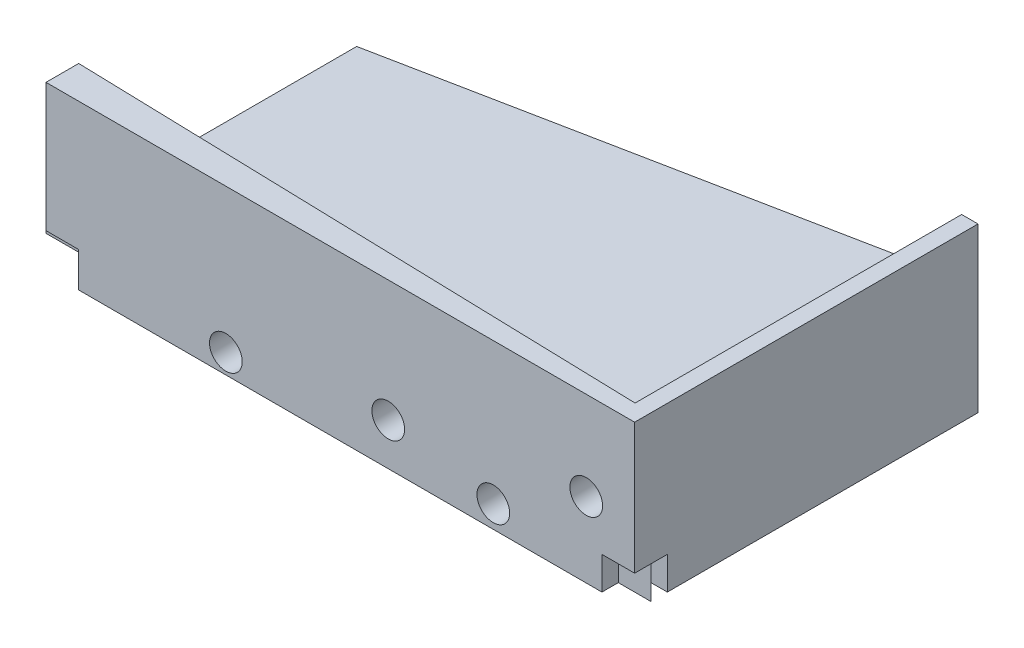
from build123d import *

# Parameters (mm, degrees)
ESQUISSE1_R             = 3
BOSS_EXTRU_1_DEPTH      = 200
ESQUISSE4_W             = 5
ESQUISSE4_H             = 50
BOSS_EXTRU_4_DEPTH      = 180
BOSS_EXTRU_7_DEPTH      = 50
ESQUISSE6_W             = 20
ESQUISSE6_H             = 10.719834163
ENL_V_MAT_EXTRU_2_DEPTH = 10
ESQUISSE5_W             = 10
ESQUISSE5_H             = 10
ENL_V_MAT_EXTRU_1_DEPTH = 10
ESQUISSE14_R            = 5
ENL_V_MAT_EXTRU_4_DEPTH = 15
BOSS_EXTRU_8_REACH      = 242.401
ESQUISSE16_W            = 210.874992539
ESQUISSE16_H            = 82.741703247
ENL_V_MAT_EXTRU_5_DEPTH = 130


with BuildPart() as part:
    # Esquisse1 → Boss.-Extru.1 (new body)
    with BuildSketch(Plane.XY):
        Polygon((-105.796013405, 0), (84.203986595, 0), (84.203986595, 33.502126335), (-105.796013405, 2), align=None)
        with Locations((69.406004871, 22.939397164)):
            Circle(ESQUISSE1_R, mode=Mode.SUBTRACT)
        with Locations((40.981469067, 6.77616521)):
            Circle(ESQUISSE1_R, mode=Mode.SUBTRACT)
        with Locations((-40.796013405, 6)):
            Circle(ESQUISSE1_R, mode=Mode.SUBTRACT)
        with Locations((8.861542866, 12.901085106)):
            Circle(ESQUISSE1_R, mode=Mode.SUBTRACT)
    extrude(amount=BOSS_EXTRU_1_DEPTH)

    # Esquisse4 → Boss.-Extru.4 (add)
    with BuildSketch(Plane(origin=(84.203986595, 0, 0), x_dir=(0, 0, -1), z_dir=(1, 0, 0))):
        with Locations((-202.5, 25)):
            Rectangle(ESQUISSE4_W, ESQUISSE4_H)
        with Locations((2.5, 25)):
            Rectangle(ESQUISSE4_W, ESQUISSE4_H)
    extrude(amount=-BOSS_EXTRU_4_DEPTH)

    # Esquisse8 → Boss.-Extru.7 (add)
    with BuildSketch(Plane(origin=(0, 50, 0), x_dir=(1, 0, 0), z_dir=(0, 1, 0))):
        Polygon((84.203986595, 0), (-95.796013405, 0), (-95.796013405, -5), align=None)
    boss_extru_7 = extrude(amount=-BOSS_EXTRU_7_DEPTH)

    # Esquisse6 → Enlèv. mat.-Extru.2 (cut)
    with BuildSketch(Plane(origin=(0, 0, -5), x_dir=(-1, 0, 0), z_dir=(0, 0, -1))):
        with Locations((95.796013405, 5.359917081)):
            Rectangle(ESQUISSE6_W, ESQUISSE6_H)
    enl_v_mat_extru_2 = extrude(amount=-ENL_V_MAT_EXTRU_2_DEPTH, mode=Mode.SUBTRACT)

    # Esquisse5 → Enlèv. mat.-Extru.1 (cut)
    with BuildSketch(Plane(origin=(84.203986595, 0, 0), x_dir=(0, 0, -1), z_dir=(1, 0, 0))):
        with Locations((-200, 5)):
            Rectangle(ESQUISSE5_W, ESQUISSE5_H)
        with Locations((0, 5)):
            Rectangle(ESQUISSE5_W, ESQUISSE5_H)
    extrude(amount=-ENL_V_MAT_EXTRU_1_DEPTH, mode=Mode.SUBTRACT)

    # Esquisse14 → Enlèv. mat.-Extru.4 (cut)
    with BuildSketch(Plane(origin=(0, 0, -5), x_dir=(-1, 0, 0), z_dir=(0, 0, -1))):
        with Locations((-69.406004871, 22.939397164)):
            Circle(ESQUISSE14_R)
        with Locations((-40.981469067, 6.77616521)):
            Circle(ESQUISSE14_R)
        with Locations((-8.861542866, 12.901085106)):
            Circle(ESQUISSE14_R)
        with Locations((40.796013405, 6)):
            Circle(ESQUISSE14_R)
    enl_v_mat_extru_4 = extrude(amount=-ENL_V_MAT_EXTRU_4_DEPTH, mode=Mode.SUBTRACT)

    # Symétrie3: Boss.-Extru.7, Enlèv. mat.-Extru.2, Enlèv. mat.-Extru.4 across plane
    add(boss_extru_7.mirror(Plane(origin=(0, 0, 100), x_dir=(1, 0, 0), z_dir=(0, 0, -1))))
    add(enl_v_mat_extru_2.mirror(Plane(origin=(0, 0, 100), x_dir=(1, 0, 0), z_dir=(0, 0, -1))), mode=Mode.SUBTRACT)
    add(enl_v_mat_extru_4.mirror(Plane(origin=(0, 0, 100), x_dir=(1, 0, 0), z_dir=(0, 0, -1))), mode=Mode.SUBTRACT)

    # Boss.-Extru.8: up to this plane
    boss_extru_8_end = Plane(origin=(-95.796013405, -180.069431054, 195), z_dir=(-0.0277670672403533, 0, 0.9996144206527183))
    # Esquisse15 → Boss.-Extru.8 (add, up to the surface)
    with BuildSketch(Plane(origin=(0, 0, -5), x_dir=(-1, 0, 0), z_dir=(0, 0, -1)), mode=Mode.PRIVATE) as boss_extru_8_sk1:
        Polygon((-84.203986595, 33.502126335), (-79.203986595, 32.67312301), (-79.203986595, 50), (-84.203986595, 50), align=None)
    boss_extru_8_tool1 = split(extrude(boss_extru_8_sk1.sketch, amount=-BOSS_EXTRU_8_REACH, mode=Mode.PRIVATE), bisect_by=boss_extru_8_end, keep=Keep.BOTH, mode=Mode.PRIVATE)
    add(boss_extru_8_tool1.solids().sort_by_distance((81.683563, 41.542119, -5))[0])

    # Esquisse16 → Enlèv. mat.-Extru.5 (cut)
    with BuildSketch(Plane(origin=(0, 0, 100), x_dir=(-1, 0, 0), z_dir=(0, 0, -1))):
        with Locations((5.796013405, 25.200829376)):
            Rectangle(ESQUISSE16_W, ESQUISSE16_H)
    extrude(amount=ENL_V_MAT_EXTRU_5_DEPTH, mode=Mode.SUBTRACT)


solid = part.part
